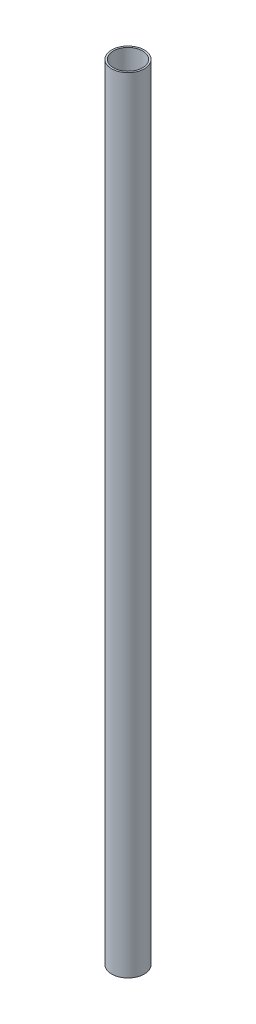
from build123d import *

# Parameters (mm, degrees)
SKETCH1_R           = 57.15
SKETCH1_R_2         = 51.1302
BOSS_EXTRUDE1_DEPTH = 2743.2


with BuildPart() as part:
    # Sketch1 → Boss-Extrude1 (new body)
    with BuildSketch(Plane(origin=(0, 0, 0), x_dir=(1, 0, 0), z_dir=(0, 1, 0))):
        with Locations(Location((0, 0, 0), (0, 0, 270))):
            Circle(SKETCH1_R)
        with Locations(Location((0, 0, 0), (0, 0, 270))):
            Circle(SKETCH1_R_2, mode=Mode.SUBTRACT)
    extrude(amount=BOSS_EXTRUDE1_DEPTH)


solid = part.part
